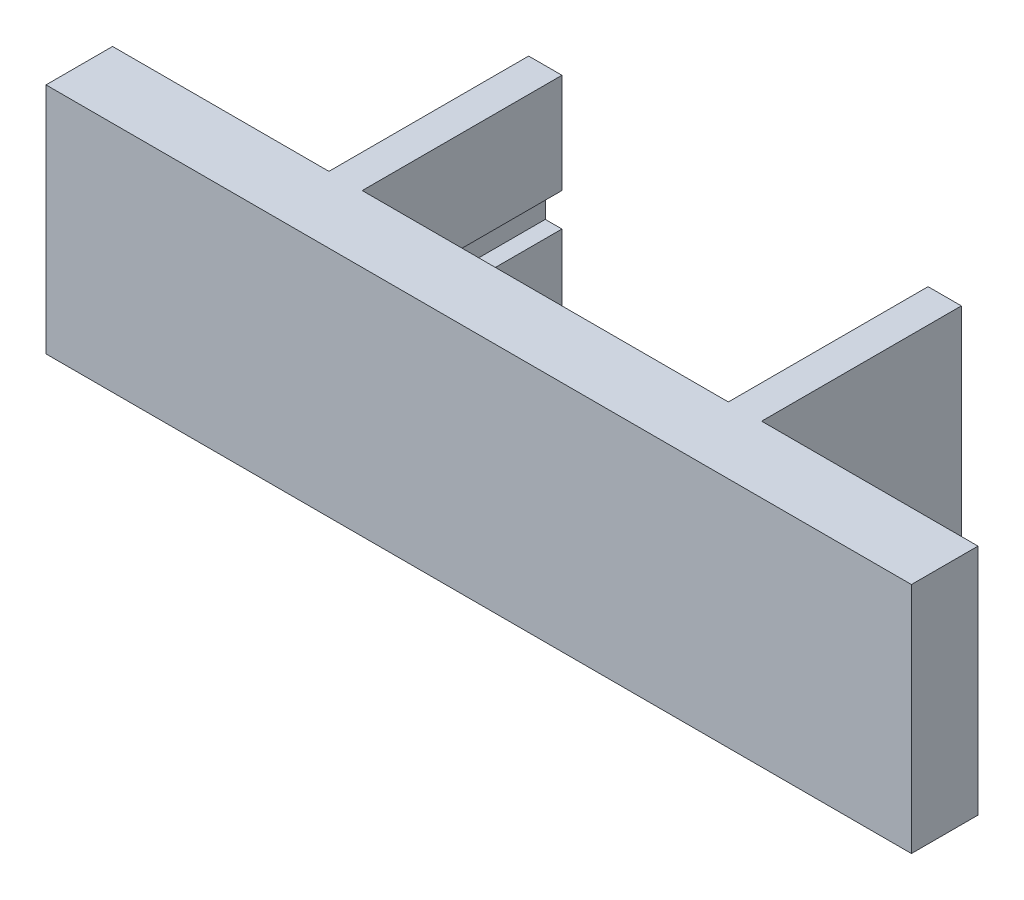
from build123d import *

# Parameters (mm, degrees)
SKETCH1_W           = 82.55
SKETCH1_H           = 22.225
BOSS_EXTRUDE1_DEPTH = 6.35
SKETCH3_W           = 3.175
SKETCH3_H           = 25.4
BOSS_EXTRUDE2_DEPTH = 22.225
CUT_EXTRUDE3_START  = 3.175
SKETCH2_W           = 38.1
SKETCH2_H           = 3.175
CUT_EXTRUDE3_DEPTH  = 50.972604439


with BuildPart() as part:
    # Sketch1 → Boss-Extrude1 (new body)
    with BuildSketch(Plane.XY):
        Rectangle(SKETCH1_W, SKETCH1_H)
    extrude(amount=BOSS_EXTRUDE1_DEPTH)

    # Sketch3 → Boss-Extrude2 (add)
    with BuildSketch(Plane(origin=(0, 11.1125, 0), x_dir=(1, 0, 0), z_dir=(0, 1, 0))):
        with Locations((-19.05, 6.35)):
            Rectangle(SKETCH3_W, SKETCH3_H)
        with Locations((19.05, 6.35)):
            Rectangle(SKETCH3_W, SKETCH3_H)
    extrude(amount=-BOSS_EXTRUDE2_DEPTH)

    # Sketch2 → Cut-Extrude3 (cut, through all)
    with BuildSketch(Plane.XY.offset(CUT_EXTRUDE3_START)):
        Rectangle(SKETCH2_W, SKETCH2_H)
    extrude(amount=-CUT_EXTRUDE3_DEPTH, mode=Mode.SUBTRACT)


solid = part.part
